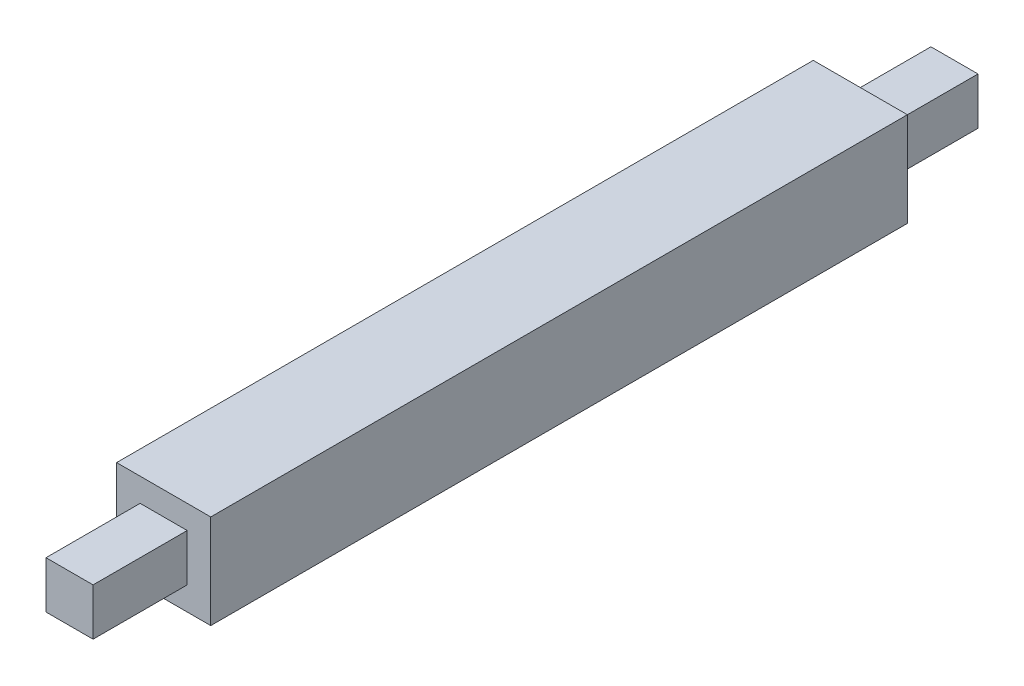
from build123d import *

# Parameters (mm, degrees)
SKETCH1_W           = 5
SKETCH1_H           = 5
BOSS_EXTRUDE1_DEPTH = 37
SKETCH2_W           = 2.5
SKETCH2_H           = 2.5
BOSS_EXTRUDE2_DEPTH = 5
SKETCH3_W           = 2.5
SKETCH3_H           = 2.5
BOSS_EXTRUDE3_DEPTH = 5


with BuildPart() as part:
    # Sketch1 → Boss-Extrude1 (new body)
    with BuildSketch(Plane.XY):
        with Locations((2.5, 2.5)):
            Rectangle(SKETCH1_W, SKETCH1_H)
    extrude(amount=BOSS_EXTRUDE1_DEPTH)

    # Sketch2 → Boss-Extrude2 (add)
    with BuildSketch(Plane.XY.offset(37)):
        with Locations((2.5, 2.5)):
            Rectangle(SKETCH2_W, SKETCH2_H)
    extrude(amount=BOSS_EXTRUDE2_DEPTH)

    # Sketch3 → Boss-Extrude3 (add)
    with BuildSketch(Plane(origin=(0, 0, 0), x_dir=(-1, 0, 0), z_dir=(0, 0, -1))):
        with Locations((-2.5, 2.5)):
            Rectangle(SKETCH3_W, SKETCH3_H)
    extrude(amount=BOSS_EXTRUDE3_DEPTH)


solid = part.part
